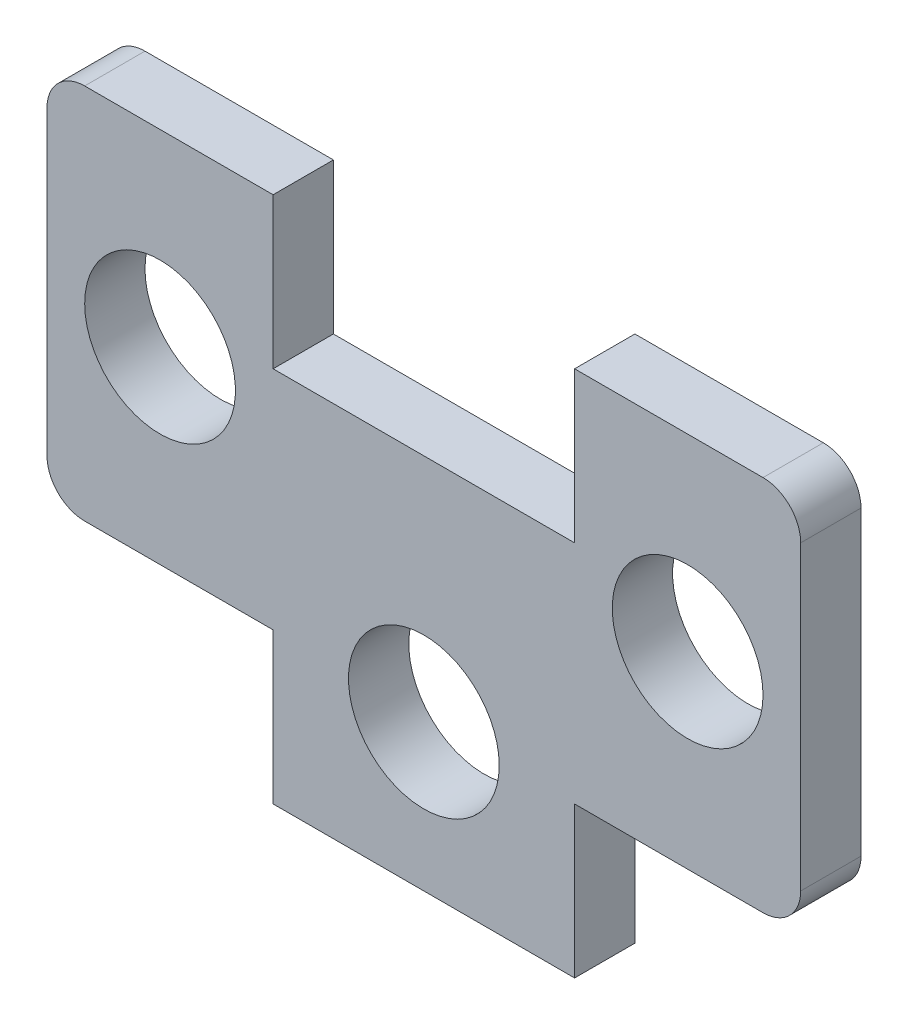
from build123d import *

# Parameters (mm, degrees)
SKETCH1_R           = 50
BOSS_EXTRUDE1_DEPTH = 40


with BuildPart() as part:
    # Sketch1 → Boss-Extrude1 (new body)
    with BuildSketch(Plane.XY):
        with BuildLine():
            Line((-100, -122.09449171), (-100, -222.09449171))
            Line((-100, -222.09449171), (100, -222.09449171))
            Line((100, -222.09449171), (100, -122.09449171))
            Line((100, -122.09449171), (225, -122.09449171))
            ThreePointArc((225, -122.09449171), (242.67766953, -114.772161239), (250, -97.09449171))
            Line((250, -97.09449171), (250, 102.90550829))
            ThreePointArc((250, 102.90550829), (242.67766953, 120.58317782), (225, 127.90550829))
            Line((225, 127.90550829), (100, 127.90550829))
            Line((100, 127.90550829), (100, 27.90550829))
            Line((100, 27.90550829), (-100, 27.90550829))
            Line((-100, 27.90550829), (-100, 127.90550829))
            Line((-100, 127.90550829), (-225, 127.90550829))
            ThreePointArc((-225, 127.90550829), (-242.67766953, 120.58317782), (-250, 102.90550829))
            Line((-250, 102.90550829), (-250, -97.09449171))
            ThreePointArc((-250, -97.09449171), (-242.67766953, -114.772161239), (-225, -122.09449171))
            Line((-225, -122.09449171), (-100, -122.09449171))
        make_face()
        with Locations((0, -125)):
            Circle(SKETCH1_R, mode=Mode.SUBTRACT)
        with Locations((175, 2.90550829)):
            Circle(SKETCH1_R, mode=Mode.SUBTRACT)
        with Locations(Location((-175, 2.90550829, 0), (0, 0, 180))):
            Circle(SKETCH1_R, mode=Mode.SUBTRACT)
    extrude(amount=BOSS_EXTRUDE1_DEPTH)


solid = part.part
